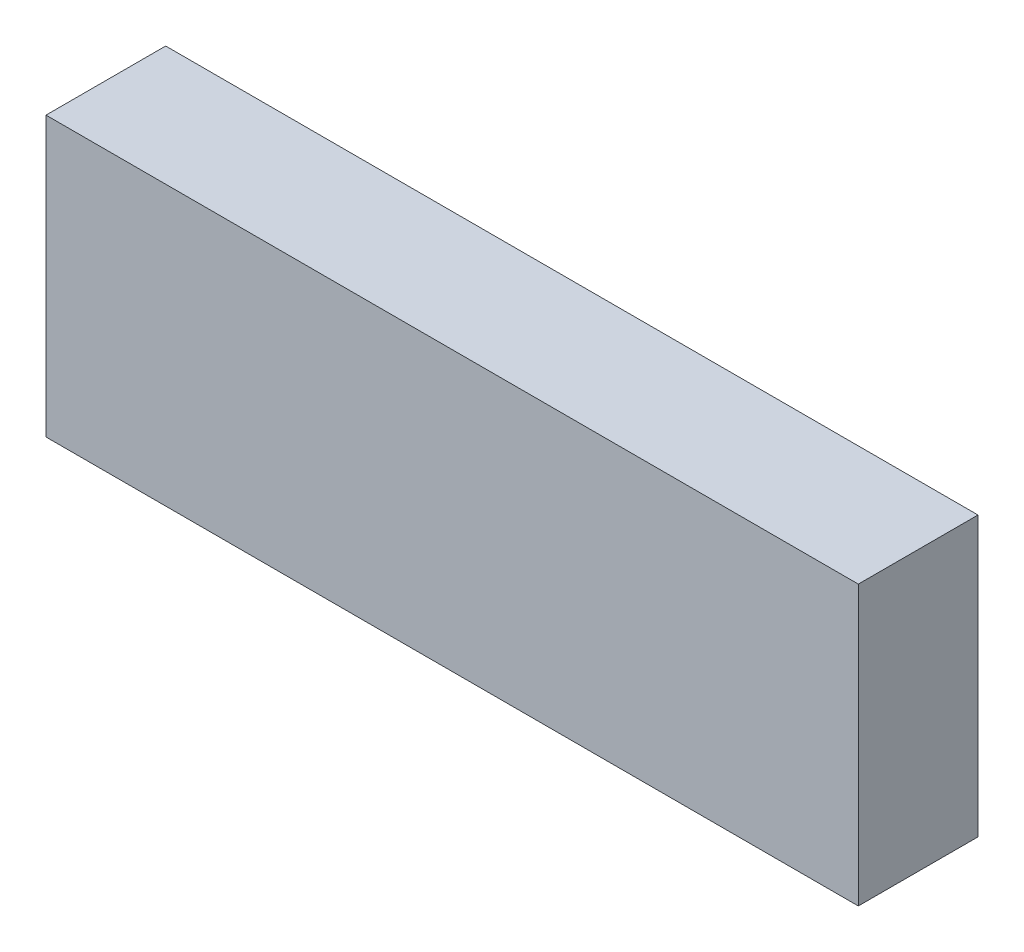
from build123d import *

# Parameters (mm, degrees)
SKETCH1_W           = 67.8688
SKETCH1_H           = 23.2918
BOSS_EXTRUDE1_DEPTH = 10


with BuildPart() as part:
    # Sketch1 → Boss-Extrude1 (new body)
    with BuildSketch(Plane.XY):
        with Locations((33.9344, -11.6459)):
            Rectangle(SKETCH1_W, SKETCH1_H)
    extrude(amount=BOSS_EXTRUDE1_DEPTH)


solid = part.part
